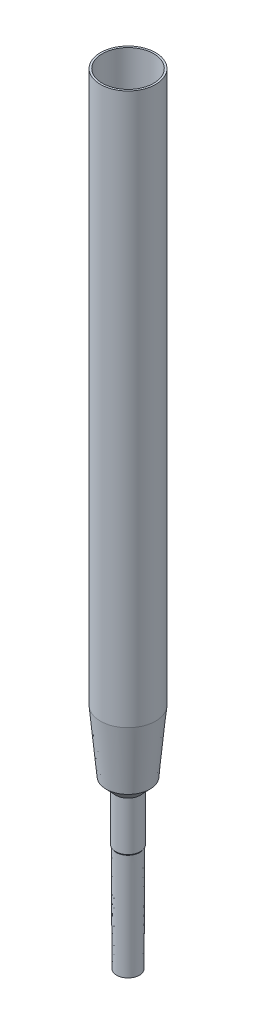
from build123d import *


with BuildPart() as part:
    # Sketch1 → Base-Revolve (revolve)
    with BuildSketch(Plane.XY, mode=Mode.PRIVATE) as base_revolve_sk:
        Polygon((-0.99999907, 0), (-1.2, 0), (-1.25, 16.399999998), (-2.3, 17.5), (-2.9, 24), (-2.9, 82), (-2.7, 82), (-2.7, 24.00921119), (-2.107247336, 17.587723996), (-1.050244154, 16.480387327), align=None)
    revolve(base_revolve_sk.sketch.rotate(Axis((0, 0, 0), (0, 1, 0)), 270), axis=Axis((0, 0, 0), (0, 1, 0)))

    # Esboço1 → Revolução1 (revolve)
    with BuildSketch(Plane.XY, mode=Mode.PRIVATE) as revolu_o1_sk:
        Polygon((-1.234146341, 11.2), (-1.3, 11.314061882), (-1.3, 16.45238095), (-1.25, 16.399999998), align=None)
    revolve(revolu_o1_sk.sketch.rotate(Axis((0, 0, 0), (0, 1, 0)), 90), axis=Axis((0, 0, 0), (0, 1, 0)))


solid = part.part
